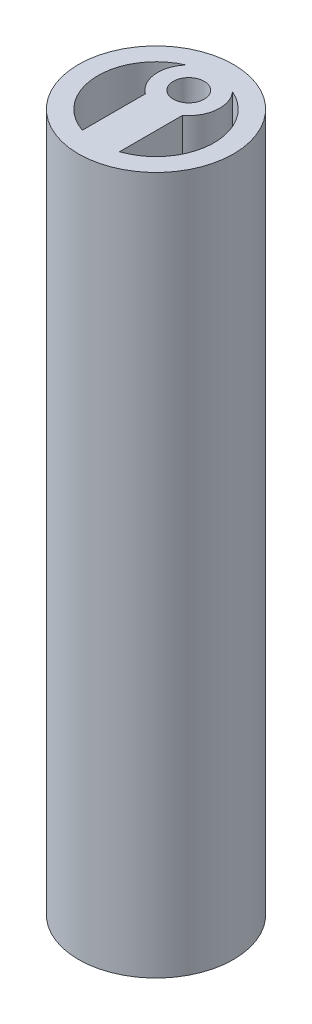
from build123d import *

# Parameters (mm, degrees)
SKETCH1_R           = 5
SKETCH1_R_2         = 3.75
BOSS_EXTRUDE1_DEPTH = 45
SKETCH3_W           = 2.4
SKETCH3_H           = 8.589481759
BOSS_EXTRUDE3_DEPTH = 45
SKETCH4_R           = 2
BOSS_EXTRUDE4_DEPTH = 45
SKETCH5_R           = 1
CUT_EXTRUDE1_DEPTH  = 46.552167896


with BuildPart() as part:
    # Sketch1 → Boss-Extrude1 (new body)
    with BuildSketch(Plane(origin=(0, 0, 0), x_dir=(1, 0, 0), z_dir=(0, 1, 0))):
        with Locations(Location((0, 0, 0), (0, 0, 90))):
            Circle(SKETCH1_R)
        with Locations(Location((0, 0, 0), (0, 0, 90))):
            Circle(SKETCH1_R_2, mode=Mode.SUBTRACT)
    extrude(amount=BOSS_EXTRUDE1_DEPTH)

    # Sketch3 → Boss-Extrude3 (add, through all)
    with BuildSketch(Plane(origin=(0, 45, 0), x_dir=(1, 0, 0), z_dir=(0, 1, 0))):
        with Locations((0, 0.061482623)):
            Rectangle(SKETCH3_W, SKETCH3_H)
    extrude(amount=-BOSS_EXTRUDE3_DEPTH)

    # Sketch4 → Boss-Extrude4 (add, through all)
    with BuildSketch(Plane(origin=(0, 45, 0), x_dir=(1, 0, 0), z_dir=(0, 1, 0))):
        with Locations((0, 2.113374327)):
            Circle(SKETCH4_R)
    extrude(amount=-BOSS_EXTRUDE4_DEPTH)

    # Sketch5 → Cut-Extrude1 (cut, through all)
    with BuildSketch(Plane(origin=(0, 45, 0), x_dir=(1, 0, 0), z_dir=(0, 1, 0))):
        with Locations(Location((0, 2.113374327, 0), (0, 0, 270))):
            Circle(SKETCH5_R)
    extrude(amount=-CUT_EXTRUDE1_DEPTH, mode=Mode.SUBTRACT)


solid = part.part
